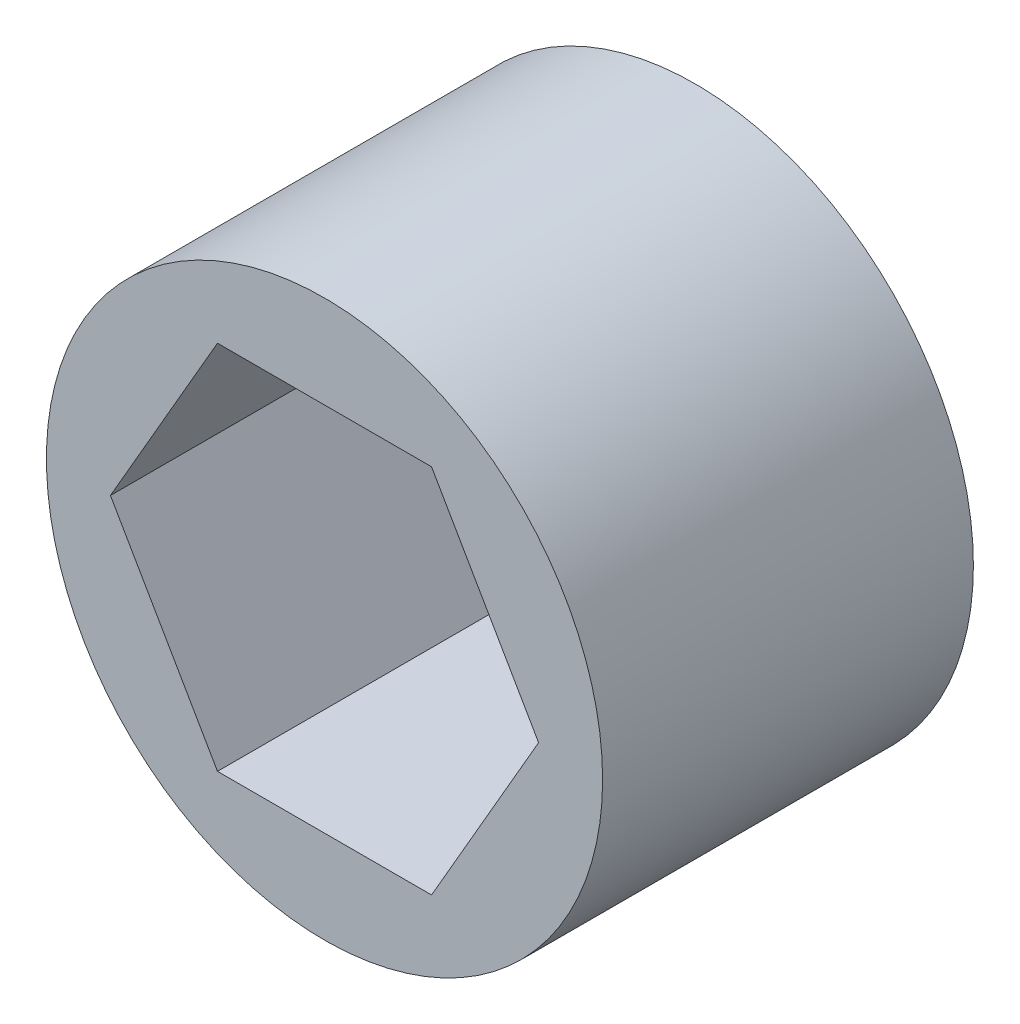
from build123d import *

# Parameters (mm, degrees)
SKETCH1_R           = 9.525
BOSS_EXTRUDE1_DEPTH = 12.7


with BuildPart() as part:
    # Sketch1 → Boss-Extrude1 (new body)
    with BuildSketch(Plane.XY):
        Circle(SKETCH1_R)
        Polygon((3.666174209, 6.35), (-3.666174209, 6.35), (-7.332348419, 0), (-3.666174209, -6.35), (3.666174209, -6.35), (7.332348419, 0), align=None, mode=Mode.SUBTRACT)
    extrude(amount=BOSS_EXTRUDE1_DEPTH)


solid = part.part
